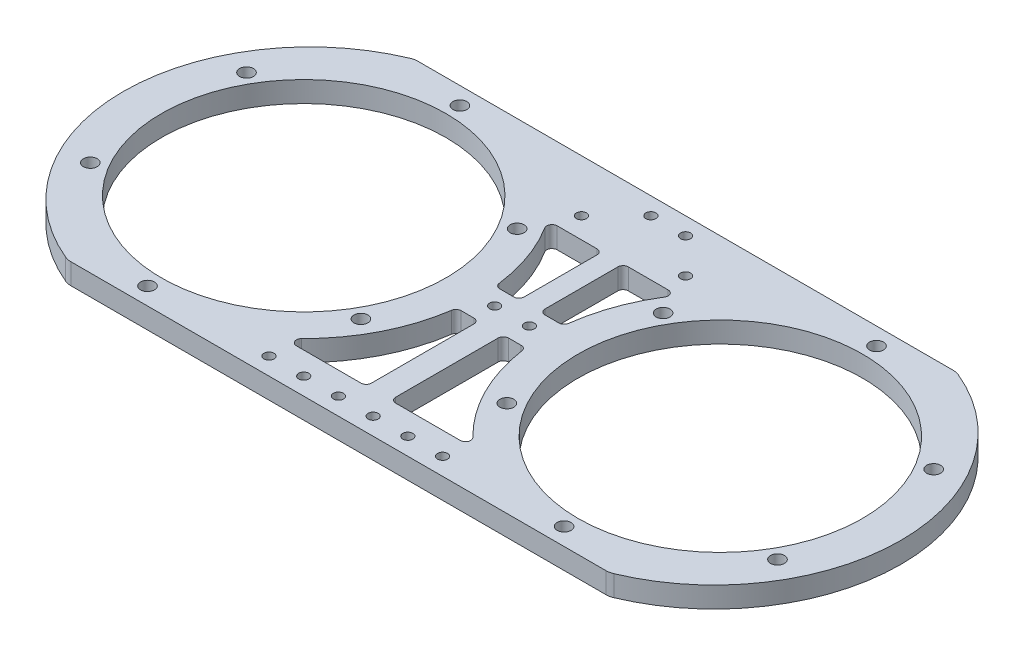
from build123d import *

# Parameters (mm, degrees)
SKETCH_1_R      = 2
SKETCH_1_R_2    = 41
SKETCH_1_R_3    = 1.45
EXTRUDE_1_DEPTH = 6


with BuildPart() as part:
    # 草图1 → 凸台-拉伸1 (new body)
    with BuildSketch(Plane(origin=(0, 0, 0), x_dir=(1, 0, 0), z_dir=(0, 1, 0))):
        with BuildLine():
            Line((-77.023496261, 50), (77.023496261, 50))
            ThreePointArc((77.023496261, 50), (78.005849606, 49.902548511), (78.949910233, 49.613992762))
            ThreePointArc((78.949910233, 49.613992762), (112, 0), (78.949910233, -49.613992762))
            ThreePointArc((78.949910233, -49.613992762), (78.005849606, -49.902548511), (77.023496261, -50))
            Line((77.023496261, -50), (-77.023496261, -50))
            ThreePointArc((-77.023496261, -50), (-78.005849606, -49.902548511), (-78.949910233, -49.613992762))
            ThreePointArc((-78.949910233, -49.613992762), (-112, 0), (-78.949910233, 49.613992762))
            ThreePointArc((-78.949910233, 49.613992762), (-78.005849606, 49.902548511), (-77.023496261, 50))
        make_face()
        with Locations(Location((60, 45, 0), (0, 0, 270))):
            Circle(SKETCH_1_R, mode=Mode.SUBTRACT)
        with Locations(Location((21.02885683, 22.5, 0), (0, 0, 270))):
            Circle(SKETCH_1_R, mode=Mode.SUBTRACT)
        with Locations(Location((21.02885683, -22.5, 0), (0, 0, 270))):
            Circle(SKETCH_1_R, mode=Mode.SUBTRACT)
        with Locations(Location((60, -45, 0), (0, 0, 270))):
            Circle(SKETCH_1_R, mode=Mode.SUBTRACT)
        with Locations(Location((98.97114317, -22.5, 0), (0, 0, 270))):
            Circle(SKETCH_1_R, mode=Mode.SUBTRACT)
        with Locations(Location((98.97114317, 22.5, 0), (0, 0, 270))):
            Circle(SKETCH_1_R, mode=Mode.SUBTRACT)
        with Locations(Location((60, 0, 0), (0, 0, 270))):
            Circle(SKETCH_1_R_2, mode=Mode.SUBTRACT)
        with Locations(Location((-60, 0, 0), (0, 0, 90))):
            Circle(SKETCH_1_R_2, mode=Mode.SUBTRACT)
        with Locations(Location((-21.02885683, -22.5, 0), (0, 0, 90))):
            Circle(SKETCH_1_R, mode=Mode.SUBTRACT)
        with Locations(Location((-21.02885683, 22.5, 0), (0, 0, 90))):
            Circle(SKETCH_1_R, mode=Mode.SUBTRACT)
        with Locations(Location((-60, 45, 0), (0, 0, 90))):
            Circle(SKETCH_1_R, mode=Mode.SUBTRACT)
        with Locations(Location((-98.97114317, 22.5, 0), (0, 0, 90))):
            Circle(SKETCH_1_R, mode=Mode.SUBTRACT)
        with Locations(Location((-98.97114317, -22.5, 0), (0, 0, 90))):
            Circle(SKETCH_1_R, mode=Mode.SUBTRACT)
        with Locations(Location((-60, -45, 0), (0, 0, 90))):
            Circle(SKETCH_1_R, mode=Mode.SUBTRACT)
        with Locations(Location((-5, 45, 0), (0, 0, 270))):
            Circle(SKETCH_1_R_3, mode=Mode.SUBTRACT)
        with Locations(Location((5, 45, 0), (0, 0, 270))):
            Circle(SKETCH_1_R_3, mode=Mode.SUBTRACT)
        with Locations(Location((-5, 0, 0), (0, 0, 270))):
            Circle(SKETCH_1_R_3, mode=Mode.SUBTRACT)
        with Locations(Location((5, 0, 0), (0, 0, 270))):
            Circle(SKETCH_1_R_3, mode=Mode.SUBTRACT)
        with Locations(Location((-5, -45, 0), (0, 0, 270))):
            Circle(SKETCH_1_R_3, mode=Mode.SUBTRACT)
        with Locations(Location((5, -45, 0), (0, 0, 270))):
            Circle(SKETCH_1_R_3, mode=Mode.SUBTRACT)
        with Locations(Location((-15, 35, 0), (0, 0, 270))):
            Circle(SKETCH_1_R_3, mode=Mode.SUBTRACT)
        with Locations(Location((15, 35, 0), (0, 0, 90))):
            Circle(SKETCH_1_R_3, mode=Mode.SUBTRACT)
        with Locations(Location((-15, -45, 0), (0, 0, 270))):
            Circle(SKETCH_1_R_3, mode=Mode.SUBTRACT)
        with Locations(Location((-25, -45, 0), (0, 0, 270))):
            Circle(SKETCH_1_R_3, mode=Mode.SUBTRACT)
        with Locations(Location((25, -45, 0), (0, 0, 90))):
            Circle(SKETCH_1_R_3, mode=Mode.SUBTRACT)
        with Locations(Location((15, -45, 0), (0, 0, 90))):
            Circle(SKETCH_1_R_3, mode=Mode.SUBTRACT)
        with BuildLine():
            Line((-3.5, -7.5), (-3.5, -37))
            ThreePointArc((-3.5, -37), (-3.939339828, -38.060660172), (-5, -38.5))
            Line((-5, -38.5), (-23.60480801, -38.5))
            ThreePointArc((-23.60480801, -38.5), (-24.992980593, -37.568310548), (-24.656692171, -35.930635838))
            ThreePointArc((-24.656692171, -35.930635838), (-15.049616268, -22.795240783), (-10.129021878, -7.283236994))
            ThreePointArc((-10.129021878, -7.283236994), (-9.625800595, -6.36528759), (-8.644766576, -6))
            Line((-8.644766576, -6), (-5, -6))
            ThreePointArc((-5, -6), (-3.939339828, -6.439339828), (-3.5, -7.5))
        make_face(mode=Mode.SUBTRACT)
        with BuildLine():
            Line((5, -6), (8.644766576, -6))
            ThreePointArc((8.644766576, -6), (9.625800595, -6.36528759), (10.129021878, -7.283236994))
            ThreePointArc((10.129021878, -7.283236994), (15.049616268, -22.795240783), (24.656692171, -35.930635838))
            ThreePointArc((24.656692171, -35.930635838), (24.992980593, -37.568310548), (23.60480801, -38.5))
            Line((23.60480801, -38.5), (5, -38.5))
            ThreePointArc((5, -38.5), (3.939339828, -38.060660172), (3.5, -37))
            Line((3.5, -37), (3.5, -7.5))
            ThreePointArc((3.5, -7.5), (3.939339828, -6.439339828), (5, -6))
        make_face(mode=Mode.SUBTRACT)
        with BuildLine():
            Line((-15.984548168, 29), (-4.5, 29))
            ThreePointArc((-4.5, 29), (-3.439339828, 28.560660172), (-3, 27.5))
            Line((-3, 27.5), (-3, 6.5))
            ThreePointArc((-3, 6.5), (-3.439339828, 5.439339828), (-4.5, 5))
            Line((-4.5, 5), (-8.508641502, 5))
            ThreePointArc((-8.508641502, 5), (-9.500661686, 5.374879583), (-9.996831054, 6.312138728))
            ThreePointArc((-9.996831054, 6.312138728), (-12.518977702, 16.90303291), (-17.256671053, 26.705202312))
            ThreePointArc((-17.256671053, 26.705202312), (-17.296454516, 28.227256306), (-15.984548168, 29))
        make_face(mode=Mode.SUBTRACT)
        with BuildLine():
            Line((15.984548168, 29), (4.5, 29))
            ThreePointArc((4.5, 29), (3.439339828, 28.560660172), (3, 27.5))
            Line((3, 27.5), (3, 6.5))
            ThreePointArc((3, 6.5), (3.439339828, 5.439339828), (4.5, 5))
            Line((4.5, 5), (8.508641502, 5))
            ThreePointArc((8.508641502, 5), (9.500661686, 5.374879583), (9.996831054, 6.312138728))
            ThreePointArc((9.996831054, 6.312138728), (12.518977702, 16.90303291), (17.256671053, 26.705202312))
            ThreePointArc((17.256671053, 26.705202312), (17.296454516, 28.227256306), (15.984548168, 29))
        make_face(mode=Mode.SUBTRACT)
    extrude(amount=EXTRUDE_1_DEPTH)


solid = part.part
